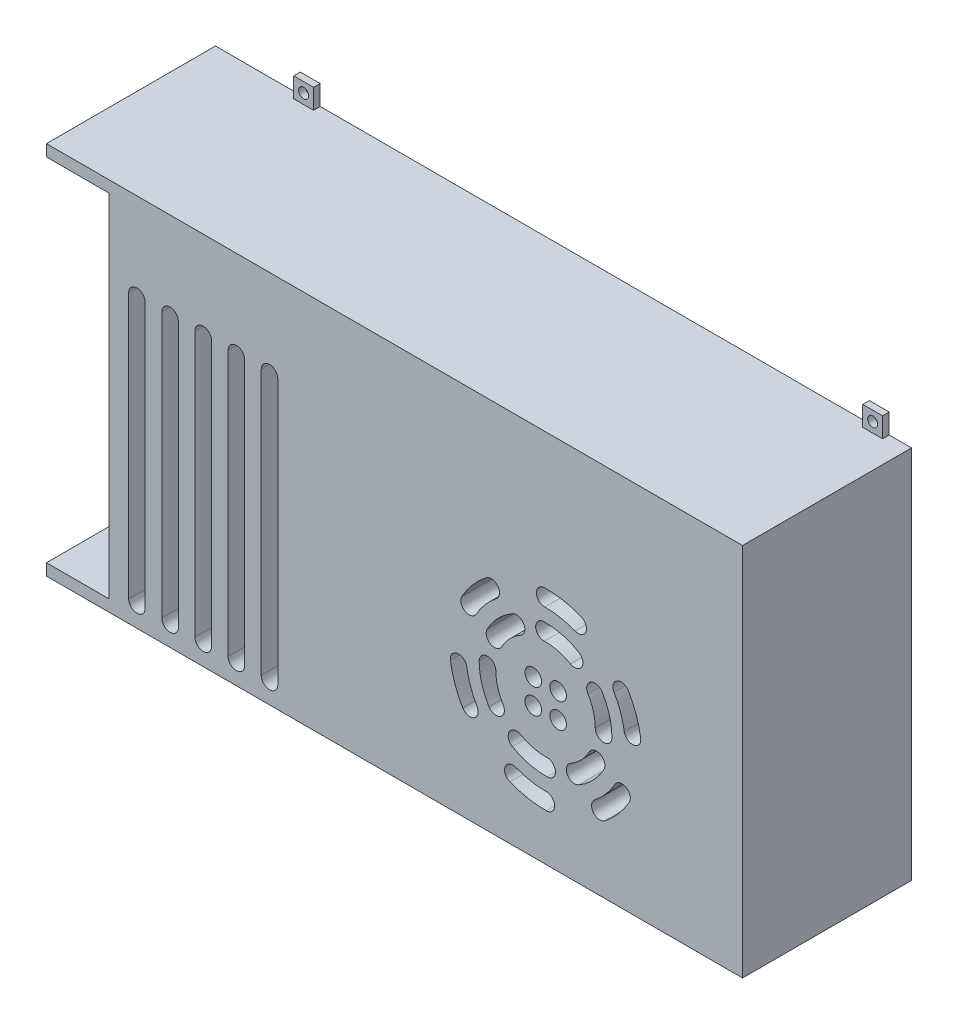
from build123d import *

# Parameters (mm, degrees)
ESBO_O1_W                = 210
ESBO_O1_H                = 113
RESSALTO_EXTRUS_O1_DEPTH = 51
ESBO_O2_R                = 2.5
CORTE_EXTRUS_O1_DEPTH    = 51
CORTE_EXTRUS_O2_DEPTH    = 51
ESBO_O4_W                = 18.837176744
ESBO_O4_H                = 106
CORTE_EXTRUS_O3_DEPTH    = 39
ESBO_O5_W                = 6
ESBO_O5_H                = 6
RESSALTO_EXTRUS_O2_DEPTH = 2
ESBO_O6_R                = 1.5
CORTE_EXTRUS_O4_DEPTH    = 148.457044521
ESBO_O7_R                = 1.5
CORTE_EXTRUS_O5_DEPTH    = 148.457044521
ESBO_O8_W                = 6
ESBO_O8_H                = 6
RESSALTO_EXTRUS_O3_DEPTH = 2
ESBO_O9_R                = 1.5
CORTE_EXTRUS_O6_DEPTH    = 148.457044521


with BuildPart() as part:
    # Esboço1 → Ressalto-extrusão1 (new body)
    with BuildSketch(Plane.XY):
        with Locations((-19.243027888, 0)):
            Rectangle(ESBO_O1_W, ESBO_O1_H)
    extrude(amount=RESSALTO_EXTRUS_O1_DEPTH)

    # Esboço2 → Corte-extrusão1 (cut)
    with BuildSketch(Plane.XY.offset(51)):
        with Locations((30.12791278, -9.396028657)):
            Circle(ESBO_O2_R)
        with Locations((22.62791278, -9.396028657)):
            Circle(ESBO_O2_R)
        with Locations((22.62791278, -16.896028657)):
            Circle(ESBO_O2_R)
        with Locations((30.12791278, -16.896028657)):
            Circle(ESBO_O2_R)
        with BuildLine():
            ThreePointArc((33.822919513, -0.400204154), (30.015030071, 1.145986464), (25.930424698, 1.600658183))
            ThreePointArc((25.930424698, 1.600658183), (23.350568744, 4.046940897), (25.796851458, 6.626796851))
            ThreePointArc((25.796851458, 6.626796851), (31.250592932, 6.019721801), (36.334864895, 3.955257029))
            ThreePointArc((36.334864895, 3.955257029), (37.256622795, 0.521553746), (33.822919513, -0.400204154))
        make_face()
        with BuildLine():
            ThreePointArc((35.239711452, 8.890426616), (30.759735868, 10.193403901), (26.112312888, 10.604974905))
            ThreePointArc((26.112312888, 10.604974905), (23.589851495, 13.082309867), (26.067186457, 15.604771261))
            ThreePointArc((26.067186457, 15.604771261), (31.682822558, 15.107456298), (37.096126389, 13.533025412))
            ThreePointArc((37.096126389, 13.533025412), (38.489218319, 10.283518546), (35.239711452, 8.890426616))
        make_face()
        with BuildLine():
            ThreePointArc((41.328918156, -13.387120046), (40.76401379, -9.316295745), (39.115468362, -5.551587868))
            ThreePointArc((39.115468362, -5.551587868), (39.944083361, -2.094225717), (43.401445512, -2.922840715))
            ThreePointArc((43.401445512, -2.922840715), (45.602573834, -7.949456902), (46.356830877, -13.384797967))
            ThreePointArc((46.356830877, -13.384797967), (43.844035556, -15.899915367), (41.328918156, -13.387120046))
        make_face()
        with BuildLine():
            ThreePointArc((33.834918399, -26.380963497), (37.077903475, -23.856329815), (39.513963421, -20.546293656))
            ThreePointArc((39.513963421, -20.546293656), (42.922434373, -19.53521422), (43.933513809, -22.943685172))
            ThreePointArc((43.933513809, -22.943685172), (40.680900657, -27.363226309), (36.350885738, -30.734102602))
            ThreePointArc((36.350885738, -30.734102602), (32.916332516, -29.815516719), (33.834918399, -26.380963497))
        make_face()
        with BuildLine():
            ThreePointArc((18.834919999, -26.387891057), (22.642809441, -27.934081676), (26.727414815, -28.388753395))
            ThreePointArc((26.727414815, -28.388753395), (29.307270768, -30.835036109), (26.860988054, -33.414892062))
            ThreePointArc((26.860988054, -33.414892062), (21.40724658, -32.807817013), (16.322974617, -30.743352241))
            ThreePointArc((16.322974617, -30.743352241), (15.401216717, -27.309648958), (18.834919999, -26.387891057))
        make_face()
        with BuildLine():
            ThreePointArc((11.328921356, -13.400975166), (11.893825722, -17.471799467), (13.54237115, -21.236507344))
            ThreePointArc((13.54237115, -21.236507344), (12.713756151, -24.693869495), (9.256394, -23.865254496))
            ThreePointArc((9.256394, -23.865254496), (7.055265679, -18.838638309), (6.301008635, -13.403297244))
            ThreePointArc((6.301008635, -13.403297244), (8.813803956, -10.888179845), (11.328921356, -13.400975166))
        make_face()
        with BuildLine():
            ThreePointArc((18.822921113, -0.407131715), (15.579936037, -2.931765397), (13.143876092, -6.241801556))
            ThreePointArc((13.143876092, -6.241801556), (9.735405139, -7.252880992), (8.724325703, -3.84441004))
            ThreePointArc((8.724325703, -3.84441004), (11.976938855, 0.575131097), (16.306953774, 3.94600739))
            ThreePointArc((16.306953774, 3.94600739), (19.741506996, 3.027421507), (18.822921113, -0.407131715))
        make_face()
        with BuildLine():
            ThreePointArc((50.08323639, -9.968782472), (48.971660027, -5.437521165), (47.004379482, -1.2069493))
            ThreePointArc((47.004379482, -1.2069493), (47.888583797, 2.216233828), (51.311766925, 1.332029513))
            ThreePointArc((51.311766925, 1.332029513), (53.688897584, -3.77991149), (55.032052356, -9.255185569))
            ThreePointArc((55.032052356, -9.255185569), (52.914442825, -12.086392003), (50.08323639, -9.968782472))
        make_face()
        with BuildLine():
            ThreePointArc((41.172444694, -32.253256694), (44.540843916, -29.024972672), (47.22098635, -25.205971811))
            ThreePointArc((47.22098635, -25.205971811), (50.627652058, -24.260123646), (51.573500224, -27.666789354))
            ThreePointArc((51.573500224, -27.666789354), (48.334994782, -32.281415394), (44.264845723, -36.182258587))
            ThreePointArc((44.264845723, -36.182258587), (40.754144262, -35.763958155), (41.172444694, -32.253256694))
        make_face()
        with BuildLine():
            ThreePointArc((17.41812806, -35.678521828), (21.898103644, -36.981499113), (26.545526624, -37.393070117))
            ThreePointArc((26.545526624, -37.393070117), (29.067988018, -39.870405079), (26.590653055, -42.392866473))
            ThreePointArc((26.590653055, -42.392866473), (20.975016954, -41.89555151), (15.561713123, -40.321120624))
            ThreePointArc((15.561713123, -40.321120624), (14.168621193, -37.071613758), (17.41812806, -35.678521828))
        make_face()
        with BuildLine():
            ThreePointArc((2.574603122, -16.81931274), (3.686179485, -21.350574047), (5.65346003, -25.581145911))
            ThreePointArc((5.65346003, -25.581145911), (4.769255715, -29.00432904), (1.346072587, -28.120124725))
            ThreePointArc((1.346072587, -28.120124725), (-1.031058072, -23.008183722), (-2.374212844, -17.532909643))
            ThreePointArc((-2.374212844, -17.532909643), (-0.256603312, -14.701703209), (2.574603122, -16.81931274))
        make_face()
        with BuildLine():
            ThreePointArc((11.485394818, 5.465161482), (8.116995597, 2.23687746), (5.436853162, -1.582123401))
            ThreePointArc((5.436853162, -1.582123401), (2.030187454, -2.527971566), (1.084339288, 0.878694142))
            ThreePointArc((1.084339288, 0.878694142), (4.32284473, 5.493320182), (8.392993789, 9.394163375))
            ThreePointArc((8.392993789, 9.394163375), (11.90369525, 8.975862943), (11.485394818, 5.465161482))
        make_face()
    extrude(amount=-CORTE_EXTRUS_O1_DEPTH, mode=Mode.SUBTRACT)

    # Esboço3 → Corte-extrusão2 (cut)
    with BuildSketch(Plane.XY.offset(51)):
        with BuildLine():
            Line((-94.441061263, 29.935231702), (-94.441061263, -50.032631861))
            ThreePointArc((-94.441061263, -50.032631861), (-96.941061263, -52.532631861), (-99.441061263, -50.032631861))
            Line((-99.441061263, -50.032631861), (-99.441061263, 29.935231702))
            ThreePointArc((-99.441061263, 29.935231702), (-96.941061263, 32.435231702), (-94.441061263, 29.935231702))
        make_face()
        with BuildLine():
            Line((-84.441061263, 29.935231702), (-84.441061263, -50.032631861))
            ThreePointArc((-84.441061263, -50.032631861), (-86.941061263, -52.532631861), (-89.441061263, -50.032631861))
            Line((-89.441061263, -50.032631861), (-89.441061263, 29.935231702))
            ThreePointArc((-89.441061263, 29.935231702), (-86.941061263, 32.435231702), (-84.441061263, 29.935231702))
        make_face()
        with BuildLine():
            Line((-74.441061263, 29.935231702), (-74.441061263, -50.032631861))
            ThreePointArc((-74.441061263, -50.032631861), (-76.941061263, -52.532631861), (-79.441061263, -50.032631861))
            Line((-79.441061263, -50.032631861), (-79.441061263, 29.935231702))
            ThreePointArc((-79.441061263, 29.935231702), (-76.941061263, 32.435231702), (-74.441061263, 29.935231702))
        make_face()
        with BuildLine():
            Line((-64.441061263, 29.935231702), (-64.441061263, -50.032631861))
            ThreePointArc((-64.441061263, -50.032631861), (-66.941061263, -52.532631861), (-69.441061263, -50.032631861))
            Line((-69.441061263, -50.032631861), (-69.441061263, 29.935231702))
            ThreePointArc((-69.441061263, 29.935231702), (-66.941061263, 32.435231702), (-64.441061263, 29.935231702))
        make_face()
        with BuildLine():
            Line((-54.441061263, 29.935231702), (-54.441061263, -50.032631861))
            ThreePointArc((-54.441061263, -50.032631861), (-56.941061263, -52.532631861), (-59.441061263, -50.032631861))
            Line((-59.441061263, -50.032631861), (-59.441061263, 29.935231702))
            ThreePointArc((-59.441061263, 29.935231702), (-56.941061263, 32.435231702), (-54.441061263, 29.935231702))
        make_face()
    extrude(amount=-CORTE_EXTRUS_O2_DEPTH, mode=Mode.SUBTRACT)

    # Esboço4 → Corte-extrusão3 (cut)
    with BuildSketch(Plane.XY.offset(51)):
        with Locations((-114.824439516, 0)):
            Rectangle(ESBO_O4_W, ESBO_O4_H)
    extrude(amount=-CORTE_EXTRUS_O3_DEPTH, mode=Mode.SUBTRACT)

    # Esboço5 → Ressalto-extrusão2 (add)
    with BuildSketch(Plane.XY):
        with Locations((-95.653704498, 59.5)):
            Rectangle(ESBO_O5_W, ESBO_O5_H)
        with Locations((76.020221531, 59.5)):
            Rectangle(ESBO_O5_W, ESBO_O5_H)
    extrude(amount=RESSALTO_EXTRUS_O2_DEPTH)

    # Esboço6 → Corte-extrusão4 (cut, through all)
    with BuildSketch(Plane.XY.offset(2)):
        with Locations((-95.653704498, 59.5)):
            Circle(ESBO_O6_R)
    extrude(amount=-CORTE_EXTRUS_O4_DEPTH, mode=Mode.SUBTRACT)

    # Esboço7 → Corte-extrusão5 (cut, through all)
    with BuildSketch(Plane.XY.offset(2)):
        with Locations((76.020221531, 59.5)):
            Circle(ESBO_O7_R)
    extrude(amount=-CORTE_EXTRUS_O5_DEPTH, mode=Mode.SUBTRACT)

    # Esboço8 → Ressalto-extrusão3 (add)
    with BuildSketch(Plane.XY):
        with Locations((-95.653027888, -59.5)):
            Rectangle(ESBO_O8_W, ESBO_O8_H)
        with Locations((76.016972112, -59.5)):
            Rectangle(ESBO_O8_W, ESBO_O8_H)
    extrude(amount=RESSALTO_EXTRUS_O3_DEPTH)

    # Esboço9 → Corte-extrusão6 (cut, through all)
    with BuildSketch(Plane.XY.offset(2)):
        with Locations((-95.653027888, -59.5)):
            Circle(ESBO_O9_R)
        with Locations((76.016972112, -59.5)):
            Circle(ESBO_O9_R)
    extrude(amount=-CORTE_EXTRUS_O6_DEPTH, mode=Mode.SUBTRACT)


solid = part.part
